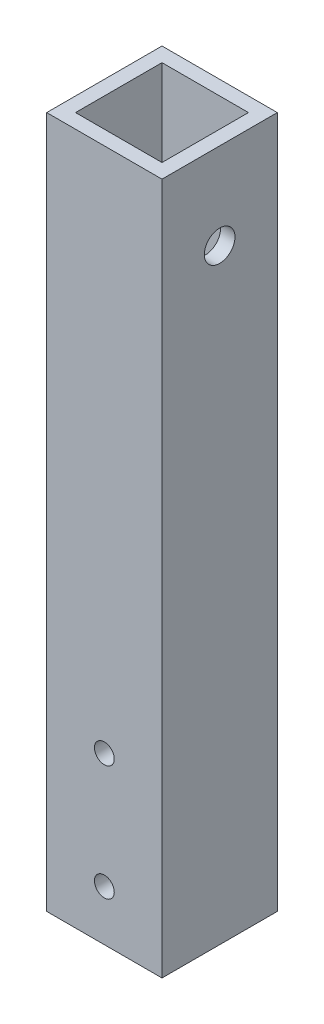
from build123d import *

# Parameters (mm, degrees)
SKETCH1_W           = 25.4
SKETCH1_H           = 25.4
SKETCH1_W_2         = 19.05
SKETCH1_H_2         = 19.05
BOSS_EXTRUDE1_DEPTH = 152.4
SKETCH2_R           = 2.1828125
CUT_EXTRUDE1_DEPTH  = 156.02325632
SKETCH3_R           = 3.3734375
CUT_EXTRUDE2_DEPTH  = 154.94


with BuildPart() as part:
    # Sketch1 → Boss-Extrude1 (new body)
    with BuildSketch(Plane(origin=(0, 0, 0), x_dir=(1, 0, 0), z_dir=(0, 1, 0))):
        Rectangle(SKETCH1_W, SKETCH1_H)
        Rectangle(SKETCH1_W_2, SKETCH1_H_2, mode=Mode.SUBTRACT)
    extrude(amount=BOSS_EXTRUDE1_DEPTH)

    # Sketch2 → Cut-Extrude1 (cut, through all)
    with BuildSketch(Plane.XY.offset(12.7)):
        with Locations((0, 11.1125)):
            Circle(SKETCH2_R)
        with Locations((0, 36.5125)):
            Circle(SKETCH2_R)
    extrude(amount=-CUT_EXTRUDE1_DEPTH, mode=Mode.SUBTRACT)

    # Sketch3 → Cut-Extrude2 (cut)
    with BuildSketch(Plane(origin=(12.7, 0, 0), x_dir=(0, 0, -1), z_dir=(1, 0, 0))):
        with Locations((0, 133.35)):
            Circle(SKETCH3_R)
    extrude(amount=-CUT_EXTRUDE2_DEPTH, mode=Mode.SUBTRACT)


solid = part.part
